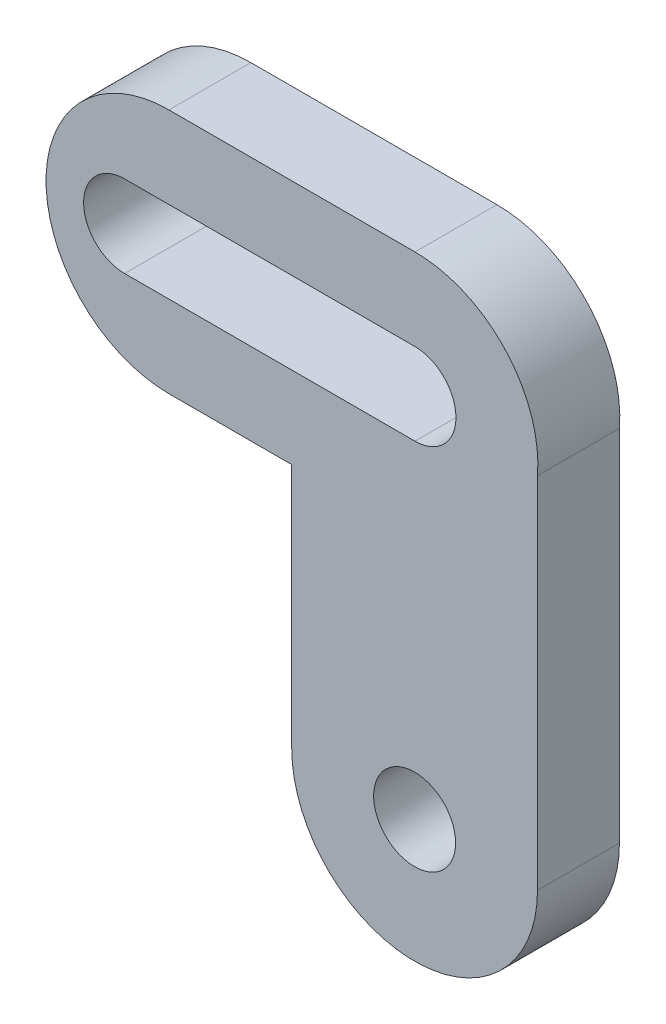
from build123d import *

# Parameters (mm, degrees)
MODEL_R                 = 1.5
SALIENTE_EXTRUIR1_DEPTH = 3


with BuildPart() as part:
    # Model → Saliente-Extruir1 (new body)
    with BuildSketch(Plane.XY):
        with BuildLine():
            Line((185.340992888, 207.251228653), (185.340992888, 220.397042101))
            ThreePointArc((185.340992888, 220.397042101), (184.159786007, 223.805419259), (180.854953221, 225.251228653))
            Line((180.854953221, 225.251228653), (171.844953221, 225.251228653))
            ThreePointArc((171.844953221, 225.251228653), (167.344953221, 220.751228653), (171.844953221, 216.251228653))
            Line((171.844953221, 216.251228653), (176.340992888, 216.251228653))
            Line((176.340992888, 216.251228653), (176.340992888, 207.251228653))
            ThreePointArc((176.340992888, 207.251228653), (180.840992888, 202.751228653), (185.340992888, 207.251228653))
        make_face()
        with Locations((180.840992888, 207.251228653)):
            Circle(MODEL_R, mode=Mode.SUBTRACT)
        with BuildLine():
            ThreePointArc((170.219953221, 219.251228653), (168.719953221, 220.751228653), (170.219953221, 222.251228653))
            Line((170.219953221, 222.251228653), (180.854953221, 222.251228653))
            ThreePointArc((180.854953221, 222.251228653), (182.354953221, 220.751228653), (180.854953221, 219.251228653))
            Line((180.854953221, 219.251228653), (170.219953221, 219.251228653))
        make_face(mode=Mode.SUBTRACT)
    extrude(amount=SALIENTE_EXTRUIR1_DEPTH)


solid = part.part
